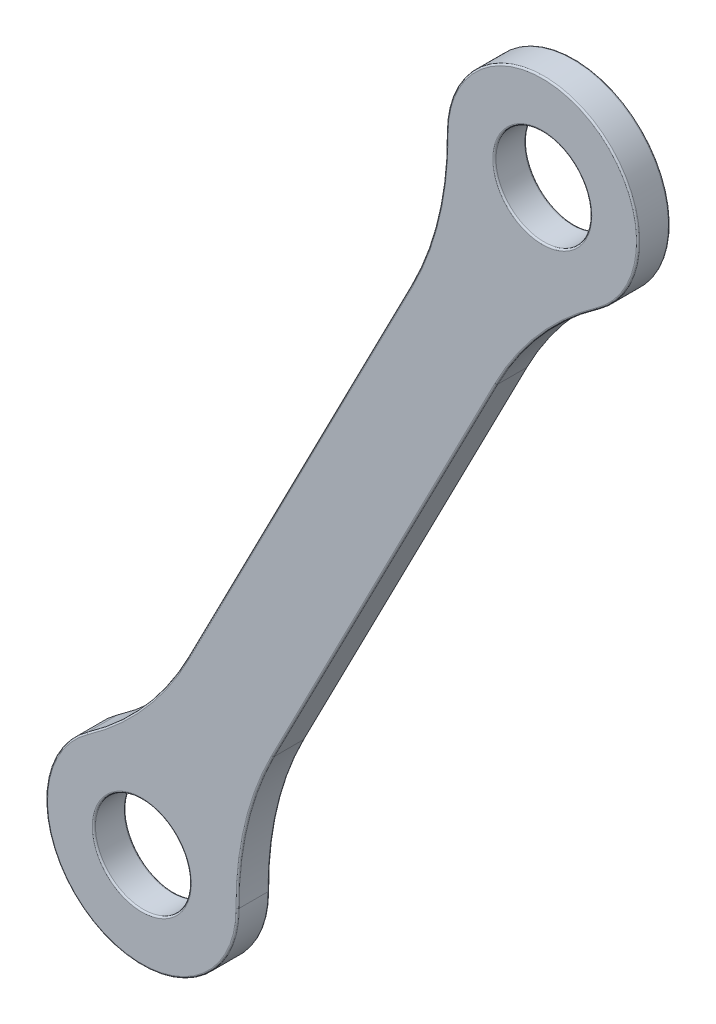
from build123d import *

# Parameters (mm, degrees)
BOSS_EXTRUDE1_DEPTH = 3
FILLET1_R           = 30
FILLET2_R           = 0.15


with BuildPart() as part:
    # Sketch1 → Boss-Extrude1 (new body)
    with BuildSketch(Plane.XY):
        with BuildLine():
            Line((10.498636235, 83.558904567), (48.11035062, 156.655129366))
            ThreePointArc((48.11035062, 156.655129366), (50.052809818, 150.594861033), (56.113078151, 152.537320231))
            Line((56.113078151, 152.537320231), (18.501363765, 79.441095433))
            ThreePointArc((18.501363765, 79.441095433), (16.558904567, 85.501363765), (10.498636235, 83.558904567))
        make_face()
        with BuildLine():
            ThreePointArc((52.546950832, 145.60675489), (56.22952352, 162.598952329), (44.544223302, 149.724564025))
            Line((44.544223302, 149.724564025), (48.11035062, 156.655129366))
            ThreePointArc((48.11035062, 156.655129366), (54.170618953, 158.597588564), (56.113078151, 152.537320231))
            Line((56.113078151, 152.537320231), (52.546950832, 145.60675489))
        make_face()
        with BuildLine():
            ThreePointArc((18.501363765, 79.441095433), (12.441095433, 77.498636235), (10.498636235, 83.558904567))
            Line((10.498636235, 83.558904567), (14.064763553, 90.489469908))
            ThreePointArc((14.064763553, 90.489469908), (10.382190865, 73.497272469), (22.067491084, 86.371660774))
            Line((22.067491084, 86.371660774), (18.501363765, 79.441095433))
        make_face()
    extrude(amount=BOSS_EXTRUDE1_DEPTH)

    # Fillet1
    fillet1_edges = [part.edges().sort_by_distance(p)[0] for p in [
        (44.544223302, 149.724564025, 1.5),
        (52.546950832, 145.60675489, 1.5),
        (22.067491084, 86.371660774, 1.5),
        (14.064763553, 90.489469908, 1.5),
    ]]
    fillet(fillet1_edges, radius=FILLET1_R)

    # Fillet2
    fillet2_edges = [part.edges().sort_by_distance(p)[0] for p in [
        (56.113078151, 152.537320231, 3),
        (29.304493428, 120.107016967, 0),
        (29.304493428, 120.107016967, 3),
        (56.22952352, 162.598952329, 0),
        (56.22952352, 162.598952329, 3),
        (37.307220958, 115.989207832, 0),
        (37.307220958, 115.989207832, 3),
        (10.498636235, 83.558904567, 3),
        (10.382190865, 73.497272469, 0),
        (10.382190865, 73.497272469, 3),
        (42.305349081, 147.292944989, 0),
        (42.305349081, 147.292944989, 3),
        (51.869923948, 142.371486199, 0),
        (51.869923948, 142.371486199, 3),
        (24.306365304, 88.80327981, 0),
        (24.306365304, 88.80327981, 3),
        (14.741790438, 93.7247386, 0),
        (14.741790438, 93.7247386, 3),
        (10.498636235, 83.558904567, 0),
        (56.113078151, 152.537320231, 0),
    ]]
    fillet(fillet2_edges, radius=FILLET2_R)


solid = part.part
